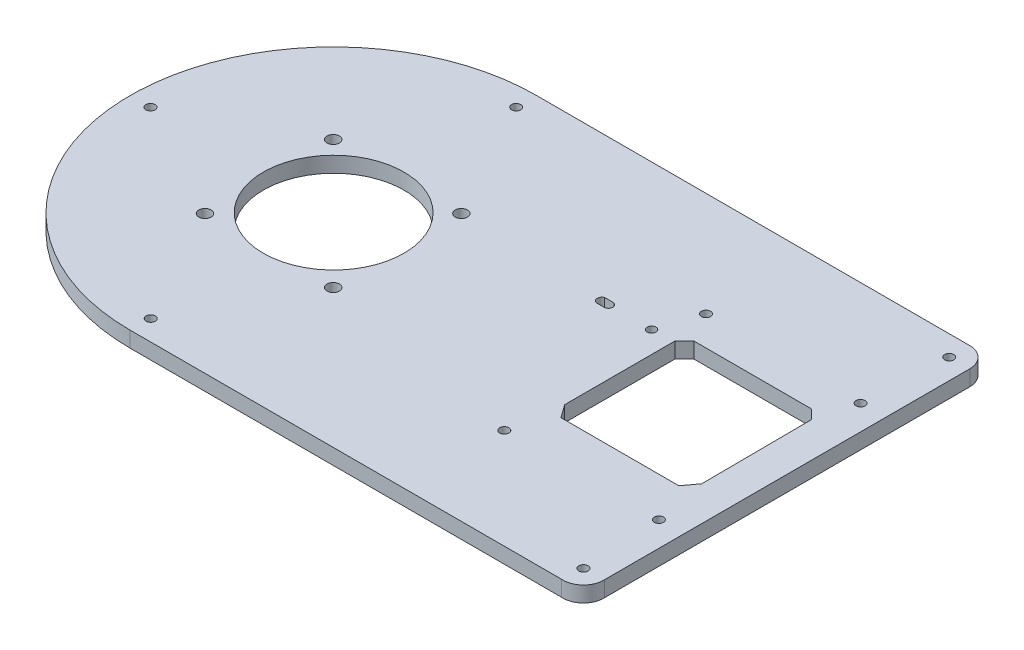
from build123d import *

# Parameters (mm, degrees)
BOSS_EXTRUDE1_DEPTH = 5
SKETCH3_R           = 1.475
CUT_EXTRUDE1_DEPTH  = 137.064643721
SKETCH4_R           = 22.5
SKETCH4_R_2         = 1.975
SKETCH4_R_3         = 1.4
SKETCH4_R_4         = 1.475
CUT_EXTRUDE2_DEPTH  = 137.064643721


with BuildPart() as part:
    # Sketch2 → Boss-Extrude1 (new body)
    with BuildSketch(Plane(origin=(0, 0, 0), x_dir=(1, 0, 0), z_dir=(0, 1, 0))):
        with BuildLine():
            Line((-52.202038886, 61.082677165), (85.797961114, 61.082677165))
            ThreePointArc((85.797961114, 61.082677165), (90.6611457, 59.421487905), (92.797961114, 54.747717054))
            Line((92.797961114, 54.747717054), (92.797961114, -62.252282946))
            ThreePointArc((92.797961114, -62.252282946), (90.782438223, -67.143884297), (85.797961114, -68.917322835))
            Line((85.797961114, -68.917322835), (-52.202038886, -68.917322835))
            ThreePointArc((-52.202038886, -68.917322835), (-117.202038886, -3.917322835), (-52.202038886, 61.082677165))
        make_face()
    extrude(amount=BOSS_EXTRUDE1_DEPTH)

    # Sketch3 → Cut-Extrude1 (cut, through all)
    with BuildSketch(Plane(origin=(0, 5, 0), x_dir=(1, 0, 0), z_dir=(0, 1, 0))):
        with Locations(Location((86.297961114, 54.582677165, 0), (0, 0, 270))):
            Circle(SKETCH3_R)
        with Locations(Location((-52.202038886, 54.582677165, 0), (0, 0, 270))):
            Circle(SKETCH3_R)
        with Locations(Location((-110.702038886, -3.912214457, 0), (0, 0, 270))):
            Circle(SKETCH3_R)
        with Locations(Location((86.297961114, -62.417322835, 0), (0, 0, 90))):
            Circle(SKETCH3_R)
        with Locations(Location((-52.110168441, -62.417322835, 0), (0, 0, 90))):
            Circle(SKETCH3_R)
    extrude(amount=-CUT_EXTRUDE1_DEPTH, mode=Mode.SUBTRACT)

    # Sketch4 → Cut-Extrude2 (cut, through all)
    with BuildSketch(Plane(origin=(0, 5, 0), x_dir=(1, 0, 0), z_dir=(0, 1, 0))):
        with Locations(Location((-52.202038886, -3.822023973, 0), (0, 0, 270))):
            Circle(SKETCH4_R)
        with Locations(Location((-72.538754153, 16.367031882, 0), (0, 0, 270))):
            Circle(SKETCH4_R_2)
        with Locations(Location((31.047961114, 14.627976027, 0), (0, 0, 270))):
            Circle(SKETCH4_R_3)
        with Locations(Location((35.409642143, 27.67666392, 0), (0, 0, 270))):
            Circle(SKETCH4_R_4)
        with Locations(Location((84.87537154, 27.67666392, 0), (0, 0, 90))):
            Circle(SKETCH4_R_4)
        with Locations(Location((84.87537154, -36.84883921, 0), (0, 0, 270))):
            Circle(SKETCH4_R_4)
        with Locations(Location((35.409642143, -36.84883921, 0), (0, 0, 90))):
            Circle(SKETCH4_R_4)
        with Locations(Location((-72.538388848, -24.642968116, 0), (0, 0, 270))):
            Circle(SKETCH4_R_2)
        with Locations(Location((-31.529119459, -24.642968116, 0), (0, 0, 90))):
            Circle(SKETCH4_R_2)
        with Locations(Location((-31.528754153, 16.367031882, 0), (0, 0, 90))):
            Circle(SKETCH4_R_2)
        Polygon((37.938439462, 15.24849763), (37.938439462, -20.06020818), (40.938439462, -24.262255151), (78.657482766, -24.262255151), (81.772324977, -20.06020818), (81.542640555, 15.24849763), (78.657482766, 18.237744849), (40.938439462, 18.237744849), align=None)
        with BuildLine():
            Line((17.447961114, 16.027976027), (14.647961114, 16.027976027))
            ThreePointArc((14.647961114, 16.027976027), (13.689795357, 14.627976027), (14.647961114, 13.227976027))
            Line((14.647961114, 13.227976027), (17.447961114, 13.227976027))
            ThreePointArc((17.447961114, 13.227976027), (18.651293074, 14.627976027), (17.447961114, 16.027976027))
        make_face()
    extrude(amount=-CUT_EXTRUDE2_DEPTH, mode=Mode.SUBTRACT)


solid = part.part
